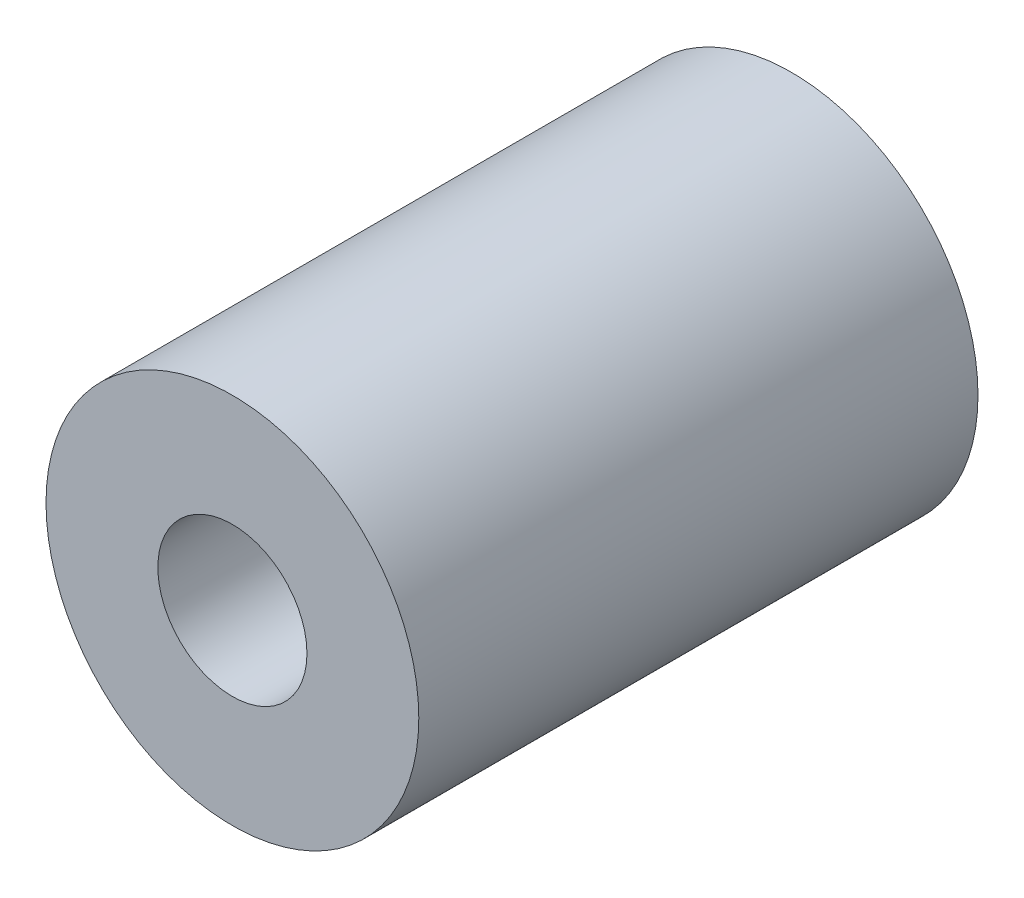
from build123d import *

# Parameters (mm, degrees)
SKETCH1_R           = 10
SKETCH1_R_2         = 0.065570397
BOSS_EXTRUDE1_DEPTH = 30
SKETCH2_R           = 4
CUT_EXTRUDE1_DEPTH  = 30
SKETCH3_R           = 5
CUT_EXTRUDE2_DEPTH  = 15


with BuildPart() as part:
    # Sketch1 → Boss-Extrude1 (new body)
    with BuildSketch(Plane.XY):
        Circle(SKETCH1_R)
        Circle(SKETCH1_R_2, mode=Mode.SUBTRACT)
    extrude(amount=BOSS_EXTRUDE1_DEPTH)

    # Sketch2 → Cut-Extrude1 (cut)
    with BuildSketch(Plane.XY.offset(30)):
        Circle(SKETCH2_R)
    extrude(amount=-CUT_EXTRUDE1_DEPTH, mode=Mode.SUBTRACT)

    # Sketch3 → Cut-Extrude2 (cut)
    with BuildSketch(Plane(origin=(0, 0, 0), x_dir=(-1, 0, 0), z_dir=(0, 0, -1))):
        Circle(SKETCH3_R)
    extrude(amount=-CUT_EXTRUDE2_DEPTH, mode=Mode.SUBTRACT)


solid = part.part
